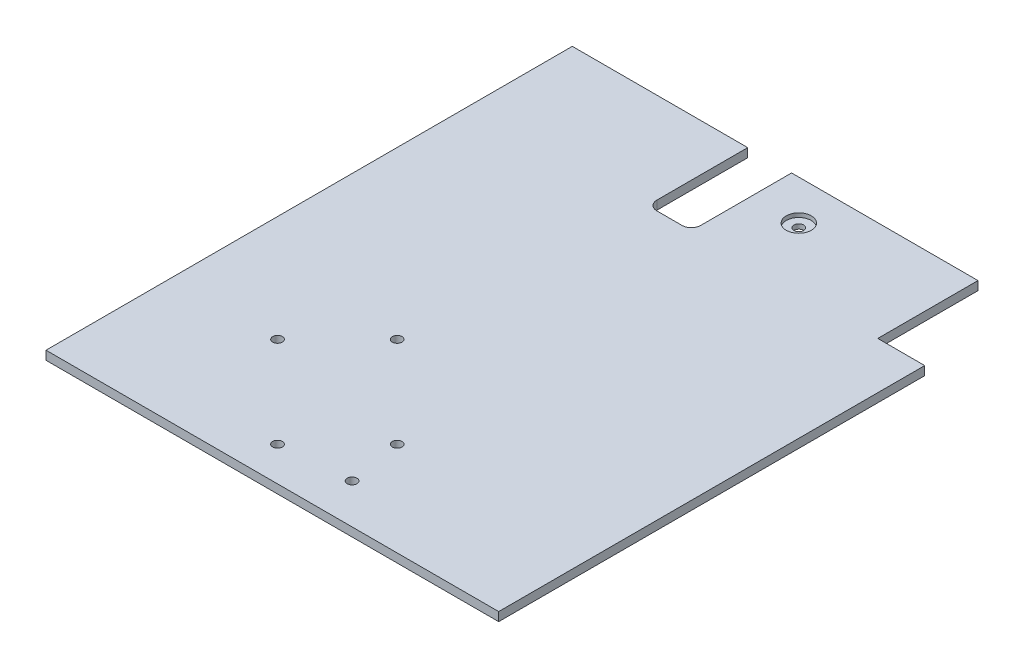
from build123d import *

# Parameters (mm, degrees)
SKETCH1_W           = 144.5
SKETCH1_H           = 168
BOSS_EXTRUDE1_DEPTH = 2.8
CUT_EXTRUDE1_REACH  = 112.833
SKETCH2_R           = 1.55
SKETCH2_W           = 15
SKETCH2_H           = 32
CUT_EXTRUDE2_REACH  = 112.833
SKETCH5_R           = 1.55
SKETCH6_R           = 4
CUT_EXTRUDE3_DEPTH  = 1.3
CUT_EXTRUDE4_REACH  = 112.833


with BuildPart() as part:
    # Sketch1 → Boss-Extrude1 (new body)
    with BuildSketch(Plane(origin=(0, 0, 0), x_dir=(1, 0, 0), z_dir=(0, 1, 0))):
        Rectangle(SKETCH1_W, SKETCH1_H)
    extrude(amount=BOSS_EXTRUDE1_DEPTH)

    # Sketch2 → Cut-Extrude1 (cut, up to next)
    with BuildSketch(Plane(origin=(0, 2.8, 0), x_dir=(1, 0, 0), z_dir=(0, 1, 0)), mode=Mode.PRIVATE) as cut_extrude1_sk1:
        with Locations(Location((-19.199747468, -24.95836944, 0), (0, 0, 270))):
            Circle(SKETCH2_R)
    cut_extrude1_tool1 = extrude(cut_extrude1_sk1.sketch, amount=-CUT_EXTRUDE1_REACH, mode=Mode.PRIVATE) & part.part
    # Sketch2 → Cut-Extrude1 (cut, up to next)
    with BuildSketch(Plane(origin=(0, 2.8, 0), x_dir=(1, 0, 0), z_dir=(0, 1, 0)), mode=Mode.PRIVATE) as cut_extrude1_sk2:
        with Locations(Location((9.79163056, -53.949747468, 0), (0, 0, 270))):
            Circle(SKETCH2_R)
    cut_extrude1_tool2 = extrude(cut_extrude1_sk2.sketch, amount=-CUT_EXTRUDE1_REACH, mode=Mode.PRIVATE) & part.part
    # Sketch2 → Cut-Extrude1 (cut, up to next)
    with BuildSketch(Plane(origin=(0, 2.8, 0), x_dir=(1, 0, 0), z_dir=(0, 1, 0)), mode=Mode.PRIVATE) as cut_extrude1_sk3:
        with Locations(Location((-9.300252532, -73.04163056, 0), (0, 0, 270))):
            Circle(SKETCH2_R)
    cut_extrude1_tool3 = extrude(cut_extrude1_sk3.sketch, amount=-CUT_EXTRUDE1_REACH, mode=Mode.PRIVATE) & part.part
    # Sketch2 → Cut-Extrude1 (cut, up to next)
    with BuildSketch(Plane(origin=(0, 2.8, 0), x_dir=(1, 0, 0), z_dir=(0, 1, 0)), mode=Mode.PRIVATE) as cut_extrude1_sk4:
        with Locations(Location((-38.29163056, -44.050252532, 0), (0, 0, 270))):
            Circle(SKETCH2_R)
    cut_extrude1_tool4 = extrude(cut_extrude1_sk4.sketch, amount=-CUT_EXTRUDE1_REACH, mode=Mode.PRIVATE) & part.part
    # Sketch2 → Cut-Extrude1 (cut, up to next)
    with BuildSketch(Plane(origin=(0, 2.8, 0), x_dir=(1, 0, 0), z_dir=(0, 1, 0)), mode=Mode.PRIVATE) as cut_extrude1_sk5:
        with Locations((64.75, 68)):
            Rectangle(SKETCH2_W, SKETCH2_H)
    cut_extrude1_tool5 = extrude(cut_extrude1_sk5.sketch, amount=-CUT_EXTRUDE1_REACH, mode=Mode.PRIVATE) & part.part
    add(cut_extrude1_tool1.solids().sort_by_distance((-19.199747, 2.8, 24.958369))[0], mode=Mode.SUBTRACT)
    add(cut_extrude1_tool2.solids().sort_by_distance((9.791631, 2.8, 53.949747))[0], mode=Mode.SUBTRACT)
    add(cut_extrude1_tool3.solids().sort_by_distance((-9.300253, 2.8, 73.041631))[0], mode=Mode.SUBTRACT)
    add(cut_extrude1_tool4.solids().sort_by_distance((-38.291631, 2.8, 44.050253))[0], mode=Mode.SUBTRACT)
    add(cut_extrude1_tool5.solids().sort_by_distance((64.75, 2.8, -68))[0], mode=Mode.SUBTRACT)

    # Sketch5 → Cut-Extrude2 (cut, up to next)
    with BuildSketch(Plane(origin=(0, 2.8, 0), x_dir=(1, 0, 0), z_dir=(0, 1, 0)), mode=Mode.PRIVATE) as cut_extrude2_sk1:
        with Locations(Location((12.75, 71.3, 0), (0, 0, 270))):
            Circle(SKETCH5_R)
    cut_extrude2_tool1 = extrude(cut_extrude2_sk1.sketch, amount=-CUT_EXTRUDE2_REACH, mode=Mode.PRIVATE) & part.part
    # Sketch5 → Cut-Extrude2 (cut, up to next)
    with BuildSketch(Plane(origin=(0, 2.8, 0), x_dir=(1, 0, 0), z_dir=(0, 1, 0)), mode=Mode.PRIVATE) as cut_extrude2_sk2:
        with Locations(Location((12.75, -71.3, 0), (0, 0, 270))):
            Circle(SKETCH5_R)
    cut_extrude2_tool2 = extrude(cut_extrude2_sk2.sketch, amount=-CUT_EXTRUDE2_REACH, mode=Mode.PRIVATE) & part.part
    add(cut_extrude2_tool1.solids().sort_by_distance((12.75, 2.8, -71.3))[0], mode=Mode.SUBTRACT)
    add(cut_extrude2_tool2.solids().sort_by_distance((12.75, 2.8, 71.3))[0], mode=Mode.SUBTRACT)

    # Sketch6 → Cut-Extrude3 (cut)
    with BuildSketch(Plane(origin=(0, 2.8, 0), x_dir=(1, 0, 0), z_dir=(0, 1, 0))):
        with Locations(Location((12.75, 71.3, 0), (0, 0, 270))):
            Circle(SKETCH6_R)
    extrude(amount=-CUT_EXTRUDE3_DEPTH, mode=Mode.SUBTRACT)

    # Sketch7 → Cut-Extrude4 (cut, up to next)
    with BuildSketch(Plane(origin=(0, 2.8, 0), x_dir=(1, 0, 0), z_dir=(0, 1, 0)), mode=Mode.PRIVATE) as cut_extrude4_sk1:
        with BuildLine():
            Line((-16.25, 84), (-16.25, 55))
            ThreePointArc((-16.25, 55), (-15.371320344, 52.878679656), (-13.25, 52))
            Line((-13.25, 52), (-5.25, 52))
            ThreePointArc((-5.25, 52), (-3.128679656, 52.878679656), (-2.25, 55))
            Line((-2.25, 55), (-2.25, 84))
            Line((-2.25, 84), (-16.25, 84))
        make_face()
    cut_extrude4_tool1 = extrude(cut_extrude4_sk1.sketch, amount=-CUT_EXTRUDE4_REACH, mode=Mode.PRIVATE) & part.part
    add(cut_extrude4_tool1.solids().sort_by_distance((-9.25, 2.8, -68.13333))[0], mode=Mode.SUBTRACT)


solid = part.part
